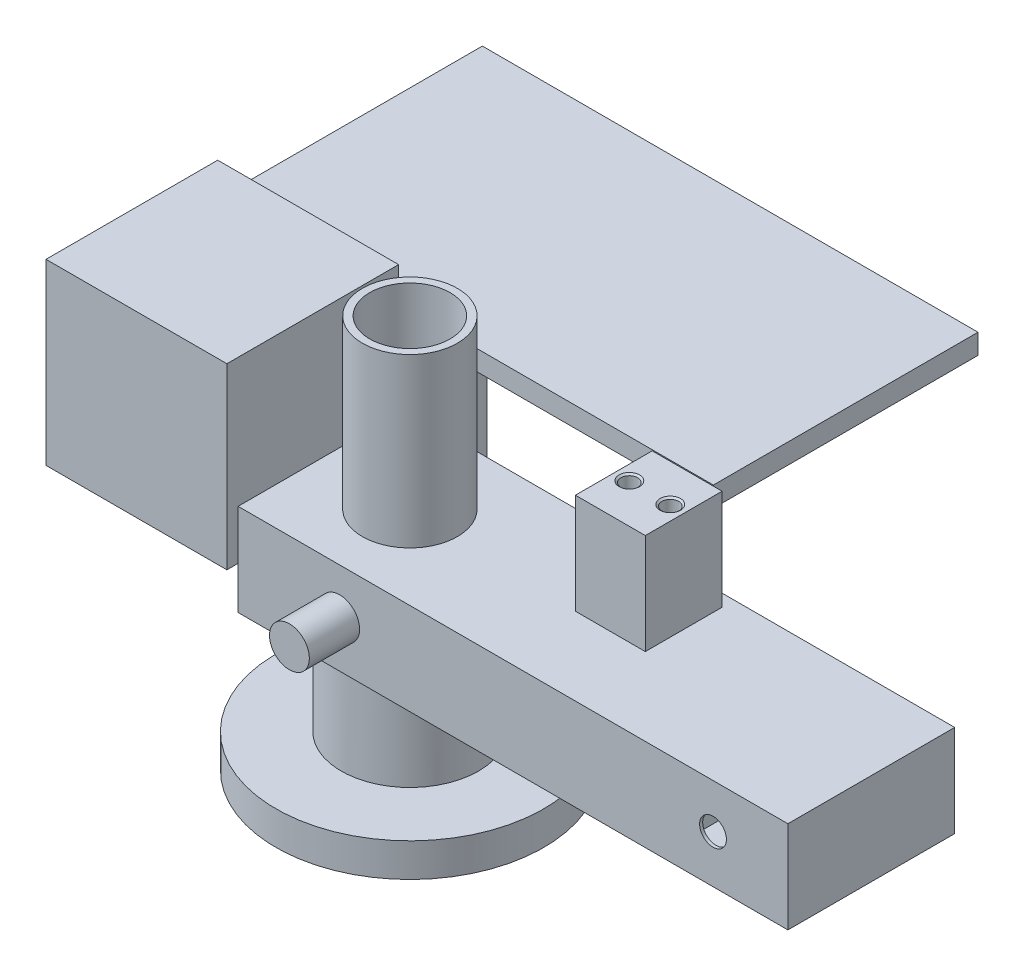
from build123d import *

# Parameters (mm, degrees)
SKETCH_1_W                   = 60.60764715
SKETCH_1_H                   = 24.895940982
EXTRUDE_1_DEPTH              = 13.730426318
SKETCH_2_W                   = 12.5
SKETCH_2_H                   = 10.5
CUT_EXTRUDE_1_DEPTH          = 42.553028861
SKETCH_3_W                   = 12.5
SKETCH_3_H                   = 10.5
EXTRUDE_2_DEPTH              = 0.5
SKETCH_4_R                   = 2
CUT_EXTRUDE_2_DEPTH          = 42.255402877
SKETCH_5_R                   = 2.975
EXTRUDE_3_DEPTH              = 7.5
SKETCH_10_W                  = 10.431635195
SKETCH_10_H                  = 11.456709174
EXTRUDE_4_DEPTH              = 15
SKETCH_14_R                  = 2.850486714
SKETCH_14_R_2                = 2
EXTRUDE_5_DEPTH              = 1.5
SKETCH_16_R                  = 7.5
SKETCH_16_R_2                = 5.5
EXTRUDE_6_DEPTH              = 15
SKETCH_17_R                  = 17.05
SKETCH_17_R_2                = 9.15
EXTRUDE_7_DEPTH              = 5
SKETCH_18_R                  = 10.251372135
EXTRUDE_8_DEPTH              = 15
SKETCH_19_R                  = 6
CUT_EXTRUDE_3_DEPTH          = 59.971905359
SKETCH_20_W                  = 1.654830839
SKETCH_20_H                  = 3.13
CUT_EXTRUDE_4_DEPTH          = 15
SKETCH_21_W                  = 0.395316647
SKETCH_21_H                  = 3.13
CUT_EXTRUDE_5_DEPTH          = 10
SKETCH_22_R                  = 19.964796935
CUT_EXTRUDE_6_DEPTH          = 10
SKETCH_47_R                  = 20
EXTRUDE_16_DEPTH             = 5
CUT_EXTRUDE_START            = -5
SKETCH_48_R                  = 6
CUT_EXTRUDE_21_DEPTH         = 5
SKETCH_49_R                  = 17.3
SKETCH_49_R_2                = 14.8
CUT_EXTRUDE_22_DEPTH         = 3
CUT_EXTRUDE_23_DEPTH         = 3
CUT_EXTRUDE_START_2          = 2.3
SKETCH_52_R                  = 18.590918847
CUT_EXTRUDE_24_DEPTH         = 2.3
SKETCH_43_W                  = 27
SKETCH_43_H                  = 28.25209616
SKETCH_43_W_2                = 24.3
SKETCH_43_H_2                = 24.3
EXTRUDE_14_DEPTH             = 10
EXTRUDE_17_DEPTH             = 5
SKETCH_54_R                  = 14.8
SKETCH_54_R_2                = 6
EXTRUDE_18_DEPTH             = 5
SKETCH_56_W                  = 1.678077589
SKETCH_56_H                  = 10
EXTRUDE_19_DEPTH             = 80
SKETCH_57_W                  = 12.5
SKETCH_57_H                  = 12
CUT_EXTRUDE_28_DEPTH         = 80
SKETCH_58_W                  = 1.678077589
SKETCH_58_H                  = 10
CUT_EXTRUDE_29_DEPTH         = 18.5
SKETCH_59_W                  = 5
SKETCH_59_H                  = 33
EXTRUDE_21_DEPTH             = 2.620970499
SKETCH_60_W                  = 25
SKETCH_60_H                  = 4.061764596
EXTRUDE_22_DEPTH             = 69.2
SKETCH_61_W                  = 26.493157549
SKETCH_61_H                  = 20
SKETCH_61_W_2                = 27.560666026
CUT_EXTRUDE_30_DEPTH         = 5.2
SKETCH_68_W                  = 86
SKETCH_68_H                  = 15
EXTRUDE_25_DEPTH             = 3
SKETCH_69_W                  = 69.2
SKETCH_69_H                  = 4.061764596
CUT_EXTRUDE_34_DEPTH         = 2
SKETCH_70_W                  = 23
SKETCH_70_H                  = 15
EXTRUDE_27_DEPTH             = 2
SKETCH_71_W                  = 23
SKETCH_71_H                  = 15
EXTRUDE_28_DEPTH             = 2
EXTRUDE_29_DEPTH             = 10.5
EXTRUDE_30_DEPTH             = 10.5
SKETCH_74_W                  = 3.65
SKETCH_74_H                  = 0.644922419
CUT_EXTRUDE_35_DEPTH         = 85.051781286
HOLE_WIZARD_M3_1_D           = 2.5
HOLE_WIZARD_M3_1_DEPTH       = 15
HOLE_WIZARD_M3_1_CSINK_D     = 3.05
HOLE_WIZARD_M3_1_CSINK_ANGLE = 100
HOLE_WIZARD_M3_1_TIP         = 0.751075774
CUT_EXTRUDE_36_DEPTH         = 114.331857654
CUT_EXTRUDE_37_DEPTH         = 109.968391882
SKETCH_87_R                  = 7.095209872
SKETCH_87_R_2                = 6
EXTRUDE_32_DEPTH             = 25
SKETCH_88_W                  = 73.978983031
SKETCH_88_H                  = 39.49779511
EXTRUDE_33_DEPTH             = 3
SKETCH_89_W                  = 24.895940982
SKETCH_89_H                  = 13.730426318
EXTRUDE_34_DEPTH             = 40
SKETCH_90_R                  = 3.757388787
CUT_EXTRUDE_38_DEPTH         = 94.859648935
SKETCH_91_W                  = 12.5
SKETCH_91_H                  = 10.5
CUT_EXTRUDE_39_DEPTH         = 80.184364024
SKETCH_92_W                  = 0.458617803
SKETCH_92_H                  = 11.143740193
EXTRUDE_35_DEPTH             = 15
SKETCH_93_R                  = 2
CUT_EXTRUDE_40_DEPTH         = 94.550231104
EXTRUDE_36_DEPTH             = 20
SKETCH_96_W                  = 27
SKETCH_96_H                  = 6.357868048
CUT_EXTRUDE_41_DEPTH         = 96.0020871
EXTRUDE_37_DEPTH             = 3


with BuildPart() as part:
    # 草圖1 → 填料-伸長1 (new body)
    with BuildSketch(Plane(origin=(0, 0, 0), x_dir=(1, 0, 0), z_dir=(0, 1, 0))):
        Rectangle(SKETCH_1_W, SKETCH_1_H)
    extrude(amount=EXTRUDE_1_DEPTH)

    # 草圖2 → 除料-伸長1 (cut, through all)
    with BuildSketch(Plane.XY.offset(12.447970491)):
        with Locations((18, 7.5)):
            Rectangle(SKETCH_2_W, SKETCH_2_H)
    extrude(amount=-CUT_EXTRUDE_1_DEPTH, mode=Mode.SUBTRACT)

    # 草圖3 → 填料-伸長2 (add)
    with BuildSketch(Plane.XY.offset(12.447970491)):
        with Locations((18, 7.5)):
            Rectangle(SKETCH_3_W, SKETCH_3_H)
    extrude(amount=-EXTRUDE_2_DEPTH)

    # 草圖4 → 除料-伸長2 (cut, through all)
    with BuildSketch(Plane(origin=(0, 0, 11.947970491), x_dir=(-1, 0, 0), z_dir=(0, 0, -1))):
        with Locations((-18, 7.5)):
            Circle(SKETCH_4_R)
    extrude(amount=-CUT_EXTRUDE_2_DEPTH, mode=Mode.SUBTRACT)

    # 草圖5 → 填料-伸長3 (add)
    with BuildSketch(Plane.XY.offset(12.447970491)):
        with Locations(Location((-15.151911787, 6.9, 0), (0, 0, 180))):
            Circle(SKETCH_5_R)
    extrude(amount=EXTRUDE_3_DEPTH)

    # 草圖10 → 填料-伸長4 (add)
    with BuildSketch(Plane(origin=(0, 13.730426318, 0), x_dir=(1, 0, 0), z_dir=(0, 1, 0))):
        with Locations((13.64237951, 4.890103919)):
            Rectangle(SKETCH_10_W, SKETCH_10_H)
    extrude(amount=EXTRUDE_4_DEPTH)

    # 草圖14 → 填料-伸長5 (add)
    with BuildSketch(Plane.XY.offset(12.447970491)):
        with Locations(Location((18, 7.5, 0), (0, 0, 180))):
            Circle(SKETCH_14_R)
        with Locations(Location((18, 7.5, 0), (0, 0, 180))):
            Circle(SKETCH_14_R_2, mode=Mode.SUBTRACT)
    extrude(amount=EXTRUDE_5_DEPTH)

    # 草圖16 → 填料-伸長6 (add)
    with BuildSketch(Plane.XZ):
        with Locations(Location((-17.11743931, 0, 0), (0, 0, 90))):
            Circle(SKETCH_16_R)
        with Locations(Location((-17.11743931, 0, 0), (0, 0, 270))):
            Circle(SKETCH_16_R_2, mode=Mode.SUBTRACT)
    extrude(amount=EXTRUDE_6_DEPTH)



with BuildPart() as body_2:
    # 草圖17 → 填料-伸長7 (new body)
    with BuildSketch(Plane.XZ.offset(15)):
        with Locations(Location((-17.11743931, 0, 0), (0, 0, 270))):
            Circle(SKETCH_17_R)
        with Locations(Location((-17.11743931, 0, 0), (0, 0, 270))):
            Circle(SKETCH_17_R_2, mode=Mode.SUBTRACT)
    extrude(amount=EXTRUDE_7_DEPTH)


with BuildPart() as part_1:
    add(part.part)

    add(body_2.part)  # 填料-伸長8 merges body 2
    # 草圖18 → 填料-伸長8 (add)
    with BuildSketch(Plane(origin=(0, -15, 0), x_dir=(1, 0, 0), z_dir=(0, 1, 0))):
        with Locations(Location((-17.11743931, 0, 0), (0, 0, 90))):
            Circle(SKETCH_18_R)
    extrude(amount=EXTRUDE_8_DEPTH)

    # 草圖19 → 除料-伸長3 (cut, through all)
    with BuildSketch(Plane.XZ.offset(15)):
        with Locations(Location((-17.11743931, 0, 0), (0, 0, 270))):
            Circle(SKETCH_19_R)
    extrude(amount=-CUT_EXTRUDE_3_DEPTH, mode=Mode.SUBTRACT)

    # 草圖20 → 除料-伸長4 (cut)
    with BuildSketch(Plane.XZ.offset(20)):
        with Locations((-26.960023891, 0)):
            Rectangle(SKETCH_20_W, SKETCH_20_H)
    extrude(amount=-CUT_EXTRUDE_4_DEPTH, mode=Mode.SUBTRACT)

    # 草圖21 → 除料-伸長5 (cut)
    with BuildSketch(Plane.XZ.offset(15)):
        with Locations((-25.934950148, 0)):
            Rectangle(SKETCH_21_W, SKETCH_21_H)
    extrude(amount=-CUT_EXTRUDE_5_DEPTH, mode=Mode.SUBTRACT)

    # 草圖22 → 除料-伸長6 (cut)
    with BuildSketch(Plane(origin=(0, -15, 0), x_dir=(1, 0, 0), z_dir=(0, 1, 0))):
        with Locations((-17.11743931, 0)):
            Circle(SKETCH_22_R)
    extrude(amount=-CUT_EXTRUDE_6_DEPTH, mode=Mode.SUBTRACT)

    # 草圖47 → 填料-伸長16 (add)
    with BuildSketch(Plane.XZ.offset(15)):
        with Locations(Location((-17.11743931, 0, 0), (0, 0, 270))):
            Circle(SKETCH_47_R)
    extrude(amount=EXTRUDE_16_DEPTH)

    # 草圖48 → 除料-伸長21 (cut)
    with BuildSketch(Plane(origin=(0, -15, 0), x_dir=(1, 0, 0), z_dir=(0, 1, 0)).offset(CUT_EXTRUDE_START)):
        with Locations(Location((-17.11743931, 0, 0), (0, 0, 90))):
            Circle(SKETCH_48_R)
    extrude(amount=CUT_EXTRUDE_21_DEPTH, mode=Mode.SUBTRACT)

    # 草圖49 → 除料-伸長22 (cut)
    with BuildSketch(Plane.XZ.offset(20)):
        with Locations(Location((-17.11743931, 0, 0), (0, 0, 270))):
            Circle(SKETCH_49_R)
        with Locations(Location((-17.11743931, 0, 0), (0, 0, 270))):
            Circle(SKETCH_49_R_2, mode=Mode.SUBTRACT)
    extrude(amount=-CUT_EXTRUDE_22_DEPTH, mode=Mode.SUBTRACT)

    # 草圖51 → 除料-伸長23 (cut)
    with BuildSketch(Plane.XZ.offset(20)):
        with BuildLine():
            Line((-3.148700639, 10.206093275), (-2.106359135, 10.967667735))
            ThreePointArc((-2.106359135, 10.967667735), (-0.785172209, 8.881402756), (0.247853998, 6.638437461))
            Line((0.247853998, 6.638437461), (-0.95795969, 6.177476703))
            ThreePointArc((-0.95795969, 6.177476703), (-1.919254477, 8.264694658), (-3.148700639, 10.206093275))
        make_face()
        with BuildLine():
            Line((-15.263072595, -17.200329185), (-15.124700518, -18.483810637))
            ThreePointArc((-15.124700518, -18.483810637), (-17.592052452, -18.584859589), (-20.051030481, -18.358003878))
            Line((-20.051030481, -18.358003878), (-19.847327363, -17.083258214))
            ThreePointArc((-19.847327363, -17.083258214), (-17.559096198, -17.294361486), (-15.263072595, -17.200329185))
        make_face()
        with BuildLine():
            Line((-32.940544695, 6.99423591), (-34.121258276, 7.516142902))
            ThreePointArc((-34.121258276, 7.516142902), (-32.975093268, 9.703456833), (-31.549141446, 11.719566418))
            Line((-31.549141446, 11.719566418), (-30.547030876, 10.905781511))
            ThreePointArc((-30.547030876, 10.905781511), (-31.873967254, 9.029666828), (-32.940544695, 6.99423591))
        make_face()
    extrude(amount=-CUT_EXTRUDE_23_DEPTH, mode=Mode.SUBTRACT)

    # 草圖52 → 除料-伸長24 (cut)
    with BuildSketch(Plane.XZ.offset(17).offset(CUT_EXTRUDE_START_2)):
        with Locations(Location((-17.11743931, 0, 0), (0, 0, 276.153288987))):
            Circle(SKETCH_52_R)
    extrude(amount=-CUT_EXTRUDE_24_DEPTH, mode=Mode.SUBTRACT)


with BuildPart() as cut_extrude_24_piece_1:
    # of the separate pieces the step leaves, piece 1, a body of its own (cut_extrude_24_pieces)
    add(part_1.part.solids().sort_by_distance((-17.11743931, -15, -20))[0])

    # 草圖43 → 填料-伸長14 (add)
    with BuildSketch(Plane.XZ):
        with Locations((-43.803823575, 0)):
            Rectangle(SKETCH_43_W, SKETCH_43_H)
        with Locations((-43.803823575, 0)):
            Rectangle(SKETCH_43_W_2, SKETCH_43_H_2, mode=Mode.SUBTRACT)
    extrude(amount=-EXTRUDE_14_DEPTH)



with BuildPart() as cut_extrude_24_piece_2:
    # of the separate pieces the step leaves, piece 2, a body of its own (cut_extrude_24_pieces)
    add(part_1.part.solids().sort_by_distance((-17.11743931, -20, -14.8))[0])


with BuildPart() as cut_extrude_24_piece_1_1:
    add(cut_extrude_24_piece_1.part)

    add(cut_extrude_24_piece_2.part)  # 填料-伸長17 merges 除料-伸長24 piece 2
    # 草圖53 → 填料-伸長17 (add)
    with BuildSketch(Plane.XZ.offset(20)):
        with BuildLine():
            Line((-21.468420385, 18.074601718), (-18.521667184, 5.83336473))
            ThreePointArc((-18.521667184, 5.83336473), (-17.137610477, 5.999966094), (-15.752464882, 5.842674457))
            Line((-15.752464882, 5.842674457), (-12.888084506, 18.10344778))
            ThreePointArc((-12.888084506, 18.10344778), (-17.1799394, 18.590813788), (-21.468420385, 18.074601718))
        make_face()
        with BuildLine():
            Line((0.711115479, -5.269240716), (-11.363483327, -1.700585353))
            ThreePointArc((-11.363483327, -1.700585353), (-11.911230667, -2.982514303), (-12.740022018, -4.103439759))
            Line((-12.740022018, -4.103439759), (-3.554071038, -12.714452591))
            ThreePointArc((-3.554071038, -12.714452591), (-0.986072247, -9.241280228), (0.711115479, -5.269240716))
        make_face()
        with BuildLine():
            Line((-30.595013023, -12.805361001), (-21.467167419, -4.132779377))
            ThreePointArc((-21.467167419, -4.132779377), (-22.303476785, -3.01745179), (-22.85983103, -1.739234698))
            Line((-22.85983103, -1.739234698), (-34.910162385, -5.388995188))
            ThreePointArc((-34.910162385, -5.388995188), (-33.186306282, -9.34953356), (-30.595013023, -12.805361001))
        make_face()
    extrude(amount=-EXTRUDE_17_DEPTH)

    # 草圖54 → 填料-伸長18 (add)
    with BuildSketch(Plane.XZ.offset(20)):
        with Locations((-17.11743931, 0)):
            Circle(SKETCH_54_R)
        with Locations(Location((-17.11743931, 0, 0), (0, 0, 270))):
            Circle(SKETCH_54_R_2, mode=Mode.SUBTRACT)
    extrude(amount=-EXTRUDE_18_DEPTH)

    # 草圖56 → 填料-伸長19 (add)
    with BuildSketch(Plane(origin=(30.303823575, 0, 0), x_dir=(0, 0, -1), z_dir=(1, 0, 0))):
        with Locations((13.287009286, 5)):
            Rectangle(SKETCH_56_W, SKETCH_56_H)
    extrude(amount=-EXTRUDE_19_DEPTH)

    # 草圖57 → 除料-伸長28 (cut)
    with BuildSketch(Plane(origin=(0, 0, -12.447970491), x_dir=(-1, 0, 0), z_dir=(0, 0, -1))):
        with Locations((-18, 6.75)):
            Rectangle(SKETCH_57_W, SKETCH_57_H)
    extrude(amount=CUT_EXTRUDE_28_DEPTH, mode=Mode.SUBTRACT)

    # 草圖58 → 除料-伸長29 (cut)
    with BuildSketch(Plane(origin=(30.303823575, 0, 0), x_dir=(0, 0, -1), z_dir=(1, 0, 0))):
        with Locations((13.287009286, 5)):
            Rectangle(SKETCH_58_W, SKETCH_58_H)
    extrude(amount=-CUT_EXTRUDE_29_DEPTH, mode=Mode.SUBTRACT)

    # 草圖59 → 填料-伸長21 (add)
    with BuildSketch(Plane(origin=(0, 0, -14.12604808), x_dir=(-1, 0, 0), z_dir=(0, 0, -1))):
        with Locations((-9.25, 26.5)):
            Rectangle(SKETCH_59_W, SKETCH_59_H)
        with Locations((22.243157549, 26.5)):
            Rectangle(SKETCH_59_W, SKETCH_59_H)
        with Locations((54.803823575, 26.5)):
            Rectangle(SKETCH_59_W, SKETCH_59_H)
    extrude(amount=-EXTRUDE_21_DEPTH)

    # 草圖60 → 填料-伸長22 (add)
    with BuildSketch(Plane.ZY.offset(57.303823575)):
        with Locations((-26.62604808, 40.969117702)):
            Rectangle(SKETCH_60_W, SKETCH_60_H)
    extrude(amount=-EXTRUDE_22_DEPTH)

    # 草圖61 → 除料-伸長30 (cut)
    with BuildSketch(Plane(origin=(0, 43, 0), x_dir=(1, 0, 0), z_dir=(0, 1, 0))):
        with Locations((-6.496578775, 24.12604808)):
            Rectangle(SKETCH_61_W, SKETCH_61_H)
        with Locations((-38.523490562, 24.12604808)):
            Rectangle(SKETCH_61_W_2, SKETCH_61_H)
    extrude(amount=-CUT_EXTRUDE_30_DEPTH, mode=Mode.SUBTRACT)

    # 草圖68 → 填料-伸長25 (add)
    with BuildSketch(Plane.XY.offset(-34.12604808)):
        with Locations((-22.761290065, 35.5)):
            Rectangle(SKETCH_68_W, SKETCH_68_H)
    extrude(amount=-EXTRUDE_25_DEPTH)

    # 草圖69 → 除料-伸長34 (cut)
    with BuildSketch(Plane(origin=(0, 0, -39.12604808), x_dir=(-1, 0, 0), z_dir=(0, 0, -1))):
        with Locations((22.703823575, 40.969117702)):
            Rectangle(SKETCH_69_W, SKETCH_69_H)
    extrude(amount=-CUT_EXTRUDE_34_DEPTH, mode=Mode.SUBTRACT)

    # 草圖70 → 填料-伸長27 (add)
    with BuildSketch(Plane(origin=(20.238709935, 0, 0), x_dir=(0, 0, -1), z_dir=(1, 0, 0))):
        with Locations((25.62604808, 35.5)):
            Rectangle(SKETCH_70_W, SKETCH_70_H)
    extrude(amount=EXTRUDE_27_DEPTH)

    # 草圖71 → 填料-伸長28 (add)
    with BuildSketch(Plane.ZY.offset(65.761290065)):
        with Locations((-25.62604808, 35.5)):
            Rectangle(SKETCH_71_W, SKETCH_71_H)
    extrude(amount=EXTRUDE_28_DEPTH)

    # 草圖72 → 填料-伸長29 (add)
    with BuildSketch(Plane.ZY.offset(57.303823575)):
        Polygon((-14.12604808, 43), (-11.505077581, 43), (-11.505077581, 27.997982017), (-14.12604808, 28), align=None)
    extrude(amount=EXTRUDE_29_DEPTH)

    # 草圖73 → 填料-伸長30 (add)
    with BuildSketch(Plane(origin=(11.75, 0, 0), x_dir=(0, 0, -1), z_dir=(1, 0, 0))):
        Polygon((11.505077581, 27.997982017), (14.12604808, 28), (14.12604808, 43), (11.505077581, 43), align=None)
    extrude(amount=EXTRUDE_30_DEPTH)

    # 草圖74 → 除料-伸長35 (cut, through all)
    with BuildSketch(Plane.XZ.offset(-10)):
        with Locations((-54.128823575, -11.827538791)):
            Rectangle(SKETCH_74_W, SKETCH_74_H)
    extrude(amount=-CUT_EXTRUDE_35_DEPTH, mode=Mode.SUBTRACT)

    # M3 螺紋孔1
    with Locations(Plane(origin=(0, 28.730426318, 0), x_dir=(1, 0, 0), z_dir=(0, 1, 0))):
        with Locations((10.585582239, 5.049791131), (16.69917678, 5.049791131)):
            CounterSinkHole(HOLE_WIZARD_M3_1_D / 2, HOLE_WIZARD_M3_1_CSINK_D / 2, depth=HOLE_WIZARD_M3_1_DEPTH, counter_sink_angle=HOLE_WIZARD_M3_1_CSINK_ANGLE)
            with Locations((0, 0, -(HOLE_WIZARD_M3_1_DEPTH + HOLE_WIZARD_M3_1_TIP / 2))):  # 118° drill point
                Cone(0, HOLE_WIZARD_M3_1_D / 2, HOLE_WIZARD_M3_1_TIP, mode=Mode.SUBTRACT)

    # 草圖83 → 除料-伸長36 (cut, through all)
    with BuildSketch(Plane.ZY.offset(67.761290065)):
        Polygon((-37.12604808, 43), (-37.12604808, 28), (-11.505077581, 27.997982017), (-11.505077581, 43), align=None)
    extrude(amount=-CUT_EXTRUDE_36_DEPTH, mode=Mode.SUBTRACT)


with BuildPart() as cut_extrude_36_piece_1:
    # of the separate pieces the step leaves, piece 1, a body of its own (cut_extrude_36_pieces)
    add(cut_extrude_24_piece_1_1.part.solids().sort_by_distance((-6.31980999, -20, -10.121818072))[0])

    # 草圖87 → 填料-伸長32 (add)
    with BuildSketch(Plane(origin=(0, 13.730426318, 0), x_dir=(1, 0, 0), z_dir=(0, 1, 0))):
        with Locations(Location((-17.11743931, 0, 0), (0, 0, 270))):
            Circle(SKETCH_87_R)
        with Locations(Location((-17.11743931, 0, 0), (0, 0, 90))):
            Circle(SKETCH_87_R_2, mode=Mode.SUBTRACT)
    extrude(amount=EXTRUDE_32_DEPTH)

    # 草圖88 → 填料-伸長33 (add)
    with BuildSketch(Plane(origin=(0, 27.997075669, 0.002205132), x_dir=(1, 0, 0), z_dir=(0, 0.9999999968981985, 7.876295579621496e-05))):
        with Locations((-20.31433206, 31.254762729)):
            Rectangle(SKETCH_88_W, SKETCH_88_H)
    extrude(amount=-EXTRUDE_33_DEPTH)

    # 草圖89 → 填料-伸長34 (add)
    with BuildSketch(Plane(origin=(11.75, 0, 0), x_dir=(0, 0, -1), z_dir=(1, 0, 0))):
        with Locations((0, 6.865213159)):
            Rectangle(SKETCH_89_W, SKETCH_89_H)
    extrude(amount=EXTRUDE_34_DEPTH)

    # 草圖90 → 除料-伸長38 (cut, through all)
    with BuildSketch(Plane.XY.offset(12.447970491)):
        with Locations((18, 7.5)):
            Circle(SKETCH_90_R)
    extrude(amount=CUT_EXTRUDE_38_DEPTH, mode=Mode.SUBTRACT)

    # 草圖91 → 除料-伸長39 (cut, through all)
    with BuildSketch(Plane(origin=(0, 0, -12.447970491), x_dir=(-1, 0, 0), z_dir=(0, 0, -1))):
        with Locations((-40.572410039, 7.112506059)):
            Rectangle(SKETCH_91_W, SKETCH_91_H)
    extrude(amount=-CUT_EXTRUDE_39_DEPTH, mode=Mode.SUBTRACT)

    # 草圖92 → 填料-伸長35 (add)
    with BuildSketch(Plane(origin=(34.322410039, 0, 0), x_dir=(0, 0, -1), z_dir=(1, 0, 0))):
        with Locations((-12.21866159, 6.790635963)):
            Rectangle(SKETCH_92_W, SKETCH_92_H)
    extrude(amount=EXTRUDE_35_DEPTH)

    # 草圖93 → 除料-伸長40 (cut, through all)
    with BuildSketch(Plane(origin=(0, 0, 11.989352688), x_dir=(-1, 0, 0), z_dir=(0, 0, -1))):
        with Locations((-40.572410039, 7.112506059)):
            Circle(SKETCH_93_R)
    extrude(amount=-CUT_EXTRUDE_40_DEPTH, mode=Mode.SUBTRACT)

    # 草圖95 → 填料-伸長36 (add)
    with BuildSketch(Plane(origin=(0, 10, 0), x_dir=(1, 0, 0), z_dir=(0, 1, 0))):
        Polygon((-55.953823575, 11.503665751), (-57.303823575, 11.503660006), (-57.303823575, -14.12604808), (-30.303823575, -14.12604808), (-30.303823575, -12.447970491), (-30.303823575, 11.50377489), (-31.653823575, 11.503769145), (-31.653823575, -12.15), (-55.953823575, -12.15), align=None)
    extrude(amount=EXTRUDE_36_DEPTH)

    # 草圖96 → 除料-伸長41 (cut, through all)
    with BuildSketch(Plane.XY.offset(14.12604808)):
        with Locations((-43.803823575, 3.178934024)):
            Rectangle(SKETCH_96_W, SKETCH_96_H)
    extrude(amount=-CUT_EXTRUDE_41_DEPTH, mode=Mode.SUBTRACT)

    # 草圖97 → 填料-伸長37 (add)
    with BuildSketch(Plane(origin=(0, 30, 0), x_dir=(1, 0, 0), z_dir=(0, 1, 0))):
        Polygon((-57.303823575, 11.503660006), (-30.303823575, 11.503717448), (-30.303823575, -14.12604808), (-57.303823575, -14.12604808), align=None)
    extrude(amount=EXTRUDE_37_DEPTH)


with BuildPart() as cut_extrude_36_piece_2:
    # of the separate pieces the step leaves, piece 2, a body of its own (cut_extrude_36_pieces)
    add(cut_extrude_24_piece_1_1.part.solids().sort_by_distance((-67.761290065, 43, -11.505077581))[0])

    # 草圖84 → 除料-伸長37 (cut, through all)
    with BuildSketch(Plane.ZY.offset(67.803823575)):
        Polygon((-18.206763024, 44.59919562), (-5.641718062, 43.50291653), (-11.505077581, 27.997982017), (-14.12604808, 27.998188452), align=None)
    extrude(amount=-CUT_EXTRUDE_37_DEPTH, mode=Mode.SUBTRACT)


solid = cut_extrude_36_piece_1.part
